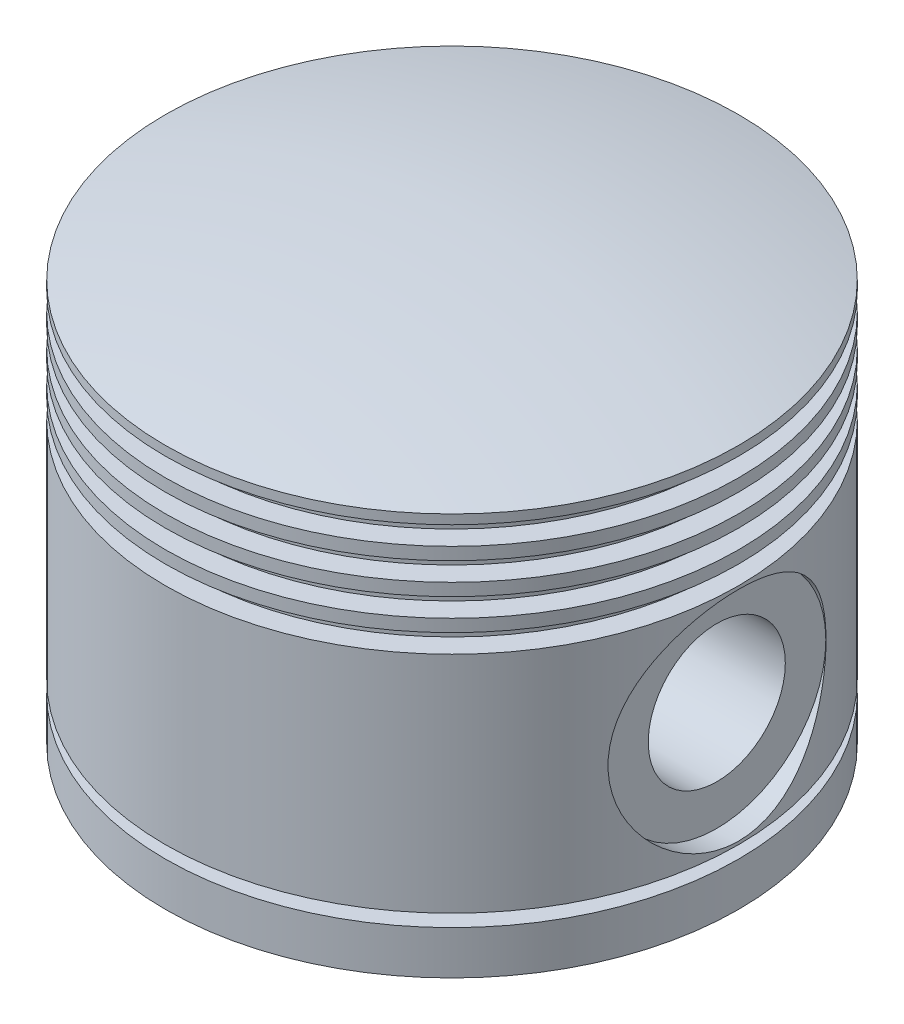
from build123d import *

# Parameters (mm, degrees)
CUT_EXTRUDE1_DEPTH       = 84.499725626
CUT_EXTRUDE1_DEPTH_BACK  = 84.499725626
SKETCH2_R                = 11
CUT_EXTRUDE2_START       = 46
SKETCH4_R                = 17.5
CUT_EXTRUDE2_DEPTH       = 3.5
BOSS_EXTRUDE5_REACH      = 104.151
BOSS_EXTRUDE5_END_RADIUS = 37
BOSS_EXTRUDE5_START      = -25
SKETCH5_R                = 18
SKETCH5_R_2              = 11


with BuildPart() as part:
    # Sketch1 → Revolve1 (revolve)
    with BuildSketch(Plane.XY):
        with BuildLine():
            Line((-46, 35.795343424), (-46, 34.295343424))
            Line((-46, 34.295343424), (-42.604482363, 34.295343424))
            Line((-42.604482363, 34.295343424), (-42.604482363, 31.295343424))
            Line((-42.604482363, 31.295343424), (-46, 31.295343424))
            Line((-46, 31.295343424), (-46, 29.295343424))
            Line((-46, 29.295343424), (-42.604482363, 29.295343424))
            Line((-42.604482363, 29.295343424), (-42.604482363, 26.295343424))
            Line((-42.604482363, 26.295343424), (-46, 26.295343424))
            Line((-46, 26.295343424), (-46, 24.295343424))
            Line((-46, 24.295343424), (-42.604482363, 24.295343424))
            Line((-42.604482363, 24.295343424), (-42.604482363, 21.295343424))
            Line((-42.604482363, 21.295343424), (-46, 21.295343424))
            Line((-46, 21.295343424), (-46, 19.295343424))
            Line((-46, 19.295343424), (-42.604482363, 19.295343424))
            Line((-42.604482363, 19.295343424), (-42.604482363, 16.295343424))
            Line((-42.604482363, 16.295343424), (-46, 16.295343424))
            Line((-46, 16.295343424), (-46, -19.704656576))
            Line((-46, -19.704656576), (-42.5, -19.704656576))
            Line((-42.5, -19.704656576), (-42.5, -21.704656576))
            Line((-42.5, -21.704656576), (-46, -21.704656576))
            Line((-46, -21.704656576), (-46, -28.704656576))
            Line((-46, -28.704656576), (-37, -28.704656576))
            Line((-37, -28.704656576), (-37, 33.295343424))
            Line((-37, 33.295343424), (0, 33.295343424))
            Line((0, 33.295343424), (0, 41.475343424))
            ThreePointArc((0, 41.475343424), (-23.17477604, 40.050783184), (-46, 35.795343424))
        make_face()
    revolve(axis=Axis((0, 41.475343424, 0), (0, -1, 0)))

    # Sketch2 → Cut-Extrude1 (cut, two sides: drawn at the far end of the back side and taken through both)
    with BuildSketch(Plane(origin=(10, 0, 0), x_dir=(0, 0, -1), z_dir=(1, 0, 0)).offset(-CUT_EXTRUDE1_DEPTH_BACK)):
        with Locations((0, -1.704656576)):
            Circle(SKETCH2_R)
    extrude(amount=CUT_EXTRUDE1_DEPTH + CUT_EXTRUDE1_DEPTH_BACK, mode=Mode.SUBTRACT)

    # Sketch4 → Cut-Extrude2 (cut)
    with BuildSketch(Plane(origin=(0, 0, 0), x_dir=(0, 0, -1), z_dir=(1, 0, 0)).offset(CUT_EXTRUDE2_START)):
        with Locations((0, -1.704656576)):
            Circle(SKETCH4_R)
    cut_extrude2 = extrude(amount=-CUT_EXTRUDE2_DEPTH, mode=Mode.SUBTRACT)

    # Mirror1: Cut-Extrude2 across plane
    add(cut_extrude2.mirror(Plane(origin=(0, 0, 0), x_dir=(0, 0, 1), z_dir=(1, 0, 0))), mode=Mode.SUBTRACT)

    # Boss-Extrude5: up to this cylinder (the profile starts inside it)
    boss_extrude5_end = Plane(origin=(0, -1.704657, 0), z_dir=(0, 1, 0)) * Cylinder(BOSS_EXTRUDE5_END_RADIUS, 283.302, mode=Mode.PRIVATE)
    # Sketch5 → Boss-Extrude5 (add, up to the surface)
    with BuildSketch(Plane(origin=(0, 0, 0), x_dir=(0, 0, -1), z_dir=(1, 0, 0)).offset(BOSS_EXTRUDE5_START), mode=Mode.PRIVATE) as boss_extrude5_sk1:
        with Locations((0, -1.704656576)):
            Circle(SKETCH5_R)
        with Locations((0, -1.704656576)):
            Circle(SKETCH5_R_2, mode=Mode.SUBTRACT)
    boss_extrude5_tool1 = extrude(boss_extrude5_sk1.sketch, amount=-BOSS_EXTRUDE5_REACH, mode=Mode.PRIVATE) & boss_extrude5_end
    boss_extrude5 = boss_extrude5_tool1.solids().sort_by_distance((-25, -1.704657, 17.490883))[0]
    add(boss_extrude5)

    # Mirror2: Boss-Extrude5 across plane
    add(boss_extrude5.mirror(Plane(origin=(0, 0, 0), x_dir=(0, 0, 1), z_dir=(1, 0, 0))))


solid = part.part
